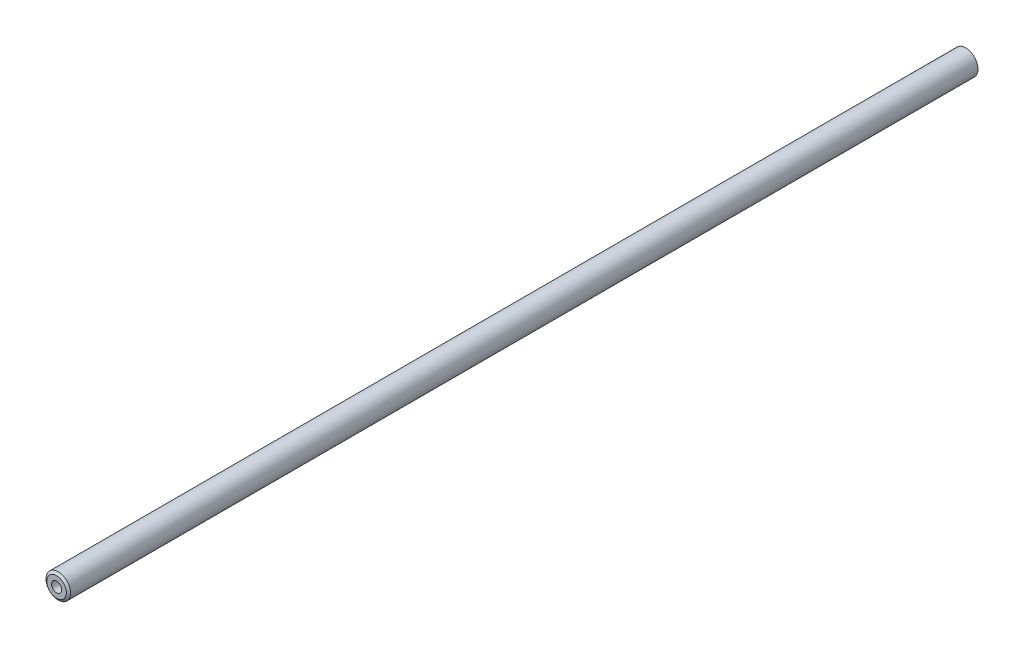
from build123d import *

# Parameters (mm, degrees)
SKETCH29_R         = 1.65
CUT_EXTRUDE1_DEPTH = 10
CUT_EXTRUDE2_START = -12
SKETCH30_R         = 1.65
CUT_EXTRUDE2_DEPTH = 12


with BuildPart() as part:
    # Sketch22 → Revolve1 (revolve)
    with BuildSketch(Plane(origin=(0, 0, 0), x_dir=(0, 0, -1), z_dir=(1, 0, 0))):
        Polygon((-148.5, 0), (-148.5, 3.2), (-147.939833969, 4), (147.939833969, 4), (148.5, 3.2), (148.5, 0), align=None)
    revolve(axis=Axis((0, 0, -148.5), (0, 0, -1)))

    # Sketch29 → Cut-Extrude1 (cut)
    with BuildSketch(Plane.XY.offset(-148.5)):
        Circle(SKETCH29_R)
    extrude(amount=CUT_EXTRUDE1_DEPTH, mode=Mode.SUBTRACT)

    # Sketch30 → Cut-Extrude2 (cut)
    with BuildSketch(Plane.XY.offset(148.5).offset(CUT_EXTRUDE2_START)):
        Circle(SKETCH30_R)
    extrude(amount=CUT_EXTRUDE2_DEPTH, mode=Mode.SUBTRACT)


solid = part.part
